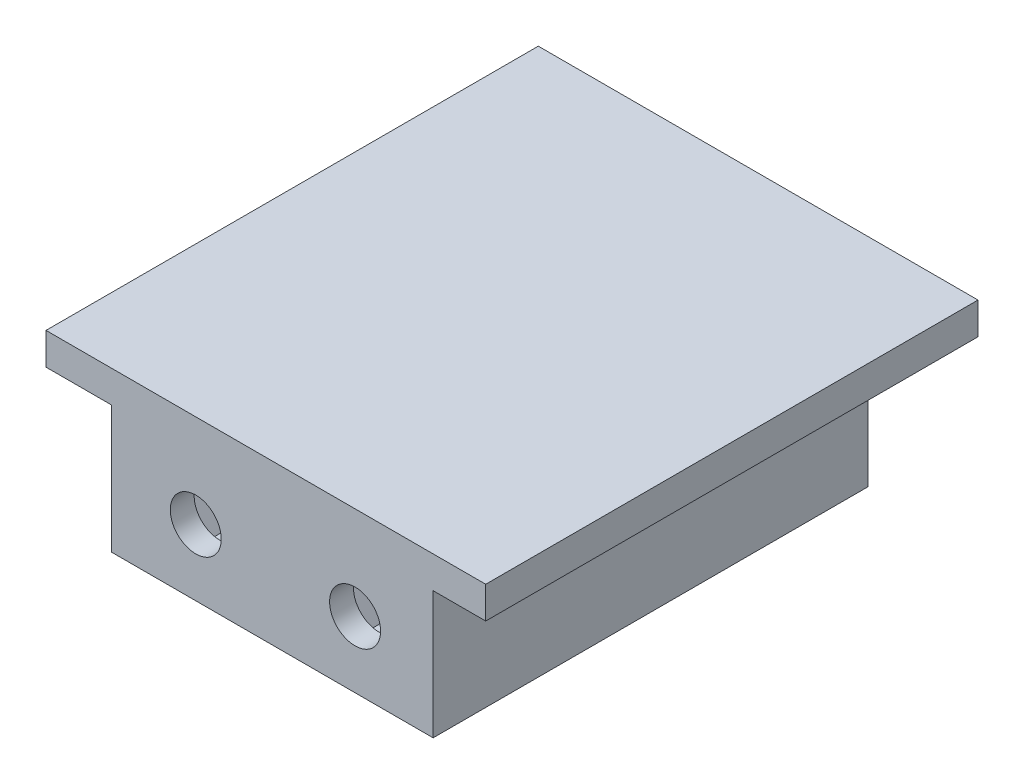
from build123d import *

# Parameters (mm, degrees)
SKETCH1_W           = 27.6
SKETCH1_H           = 30.9
BOSS_EXTRUDE1_DEPTH = 2
SKETCH2_W           = 20.2
SKETCH2_H           = 27.3
BOSS_EXTRUDE2_DEPTH = 8
SKETCH3_R           = 1.6
CUT_EXTRUDE1_DEPTH  = 32
CUT_EXTRUDE2_DEPTH  = 2.5
CUT_EXTRUDE3_DEPTH  = 2.5


with BuildPart() as part:
    # Sketch1 → Boss-Extrude1 (new body)
    with BuildSketch(Plane(origin=(0, 0, 0), x_dir=(1, 0, 0), z_dir=(0, 1, 0))):
        with Locations((25.658887851, 1.636558914)):
            Rectangle(SKETCH1_W, SKETCH1_H)
    extrude(amount=BOSS_EXTRUDE1_DEPTH)

    # Sketch2 → Boss-Extrude2 (add)
    with BuildSketch(Plane.XZ):
        with Locations((26.058887851, 0.163441086)):
            Rectangle(SKETCH2_W, SKETCH2_H)
    extrude(amount=BOSS_EXTRUDE2_DEPTH)

    # Sketch3 → Cut-Extrude1 (cut)
    with BuildSketch(Plane.XY.offset(13.813441086)):
        with Locations((21.258887851, -3.85)):
            Circle(SKETCH3_R)
        with Locations((31.258887851, -3.85)):
            Circle(SKETCH3_R)
    extrude(amount=-CUT_EXTRUDE1_DEPTH, mode=Mode.SUBTRACT)

    # Sketch4 → Cut-Extrude2 (cut)
    with BuildSketch(Plane.XY.offset(12.313441086)):
        Polygon((32.875468605, -6.65), (34.492049359, -3.85), (32.875468605, -1.05), (29.642307097, -1.05), (28.025726344, -3.85), (29.642307097, -6.65), align=None)
        Polygon((22.91999145, -6.623818337), (24.491636796, -3.798351254), (22.830533197, -1.024532917), (19.597784252, -1.076181663), (18.026138906, -3.901648746), (19.687242505, -6.675467083), align=None)
    extrude(amount=-CUT_EXTRUDE2_DEPTH, mode=Mode.SUBTRACT)

    # Sketch5 → Cut-Extrude3 (cut)
    with BuildSketch(Plane(origin=(0, 0, -11.986558914), x_dir=(-1, 0, 0), z_dir=(0, 0, -1))):
        Polygon((-29.642307097, -6.65), (-28.025726344, -3.85), (-29.642307097, -1.05), (-32.875468605, -1.05), (-34.492049359, -3.85), (-32.875468605, -6.65), align=None)
        Polygon((-19.642307097, -6.65), (-18.025726344, -3.85), (-19.642307097, -1.05), (-22.875468605, -1.05), (-24.492049359, -3.85), (-22.875468605, -6.65), align=None)
    extrude(amount=-CUT_EXTRUDE3_DEPTH, mode=Mode.SUBTRACT)


solid = part.part
